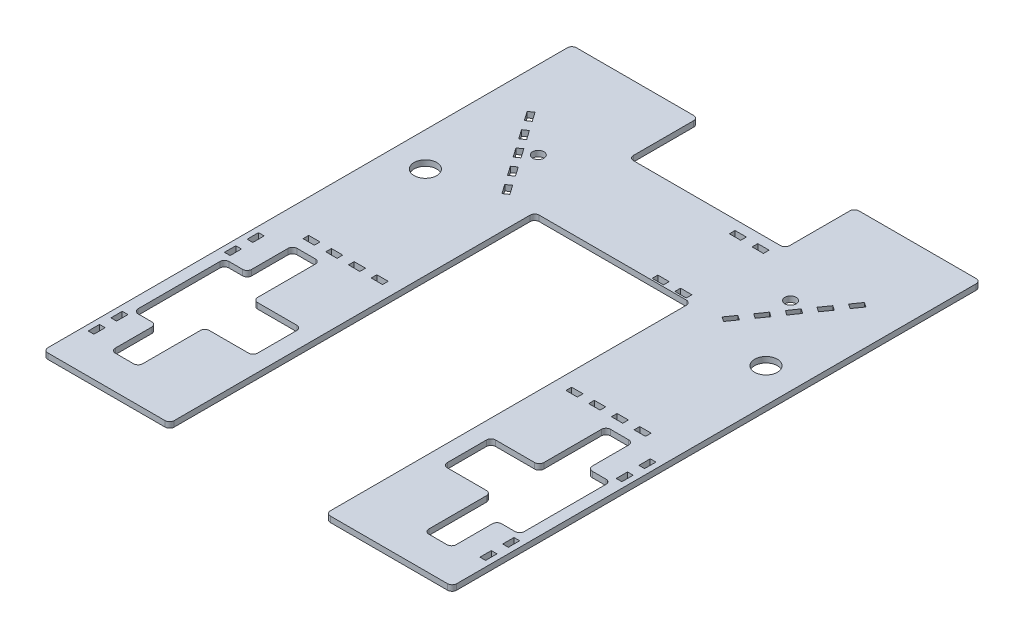
from build123d import *

# Parameters (mm, degrees)
SKETCH1_R           = 3.175
SKETCH1_R_2         = 6.35
SKETCH1_W           = 3.175
SKETCH1_H           = 6.35
SKETCH1_W_2         = 6.35
SKETCH1_H_2         = 3.175
BOSS_EXTRUDE1_DEPTH = 3.175
FILLET1_R           = 2.54


with BuildPart() as part:
    # Sketch1 → Boss-Extrude1 (new body)
    with BuildSketch(Plane(origin=(0, 0, 0), x_dir=(1, 0, 0), z_dir=(0, 1, 0))):
        Polygon((0, 0), (0, 279.4), (70.625, 279.4), (70.625, 240.639092), (157.975, 240.639092), (157.975, 279.4), (228.6, 279.4), (228.6, 0), (228.6, -16.1925), (157.975, -16.1925), (157.975, 0), (157.975, 178.425), (157.975, 187.95), (70.625, 187.95), (70.625, 178.425), (70.625, 0), (70.625, -16.1925), (0, -16.1925), align=None)
        with Locations(Location((184.833175285, 216.825060168, 0), (0, 0, 270))):
            Circle(SKETCH1_R, mode=Mode.SUBTRACT)
        with Locations(Location((209.55, 178.425, 0), (0, 0, 270))):
            Circle(SKETCH1_R_2, mode=Mode.SUBTRACT)
        with Locations(Location((43.766824715, 216.825060168, 0), (0, 0, 90))):
            Circle(SKETCH1_R, mode=Mode.SUBTRACT)
        with Locations(Location((19.05, 178.425, 0), (0, 0, 90))):
            Circle(SKETCH1_R_2, mode=Mode.SUBTRACT)
        Polygon((194.31, 66.84), (167.3225, 66.84), (167.3225, 39.84), (194.31, 39.84), (194.31, 2.54), (209.55, 2.54), (209.55, 27.94), (222.25, 27.94), (222.25, 78.74), (209.55, 78.74), (209.55, 104.14), (194.31, 104.14), align=None, mode=Mode.SUBTRACT)
        Polygon((19.05, 78.74), (6.35, 78.74), (6.35, 27.94), (19.05, 27.94), (19.05, 2.54), (34.29, 2.54), (34.29, 39.84), (61.2775, 39.84), (61.2775, 66.84), (34.29, 66.84), (34.29, 104.14), (19.05, 104.14), align=None, mode=Mode.SUBTRACT)
        with Locations((4.7625, 85.09)):
            Rectangle(SKETCH1_W, SKETCH1_H, mode=Mode.SUBTRACT)
        with Locations((4.7625, 97.79)):
            Rectangle(SKETCH1_W, SKETCH1_H, mode=Mode.SUBTRACT)
        with Locations((4.7625, 8.89)):
            Rectangle(SKETCH1_W, SKETCH1_H, mode=Mode.SUBTRACT)
        with Locations((4.7625, 21.59)):
            Rectangle(SKETCH1_W, SKETCH1_H, mode=Mode.SUBTRACT)
        with Locations((47.13, 112.0775)):
            Rectangle(SKETCH1_W_2, SKETCH1_H_2, mode=Mode.SUBTRACT)
        with Locations((59.83, 112.0775)):
            Rectangle(SKETCH1_W_2, SKETCH1_H_2, mode=Mode.SUBTRACT)
        with Locations((34.43, 112.0775)):
            Rectangle(SKETCH1_W_2, SKETCH1_H_2, mode=Mode.SUBTRACT)
        with Locations((21.73, 112.0775)):
            Rectangle(SKETCH1_W_2, SKETCH1_H_2, mode=Mode.SUBTRACT)
        with Locations((138.56250164, 233.66229998)):
            Rectangle(SKETCH1_W_2, SKETCH1_H_2, mode=Mode.SUBTRACT)
        with Locations((138.56250164, 190.48729998)):
            Rectangle(SKETCH1_W_2, SKETCH1_H_2, mode=Mode.SUBTRACT)
        with Locations((151.26250164, 190.48729998)):
            Rectangle(SKETCH1_W_2, SKETCH1_H_2, mode=Mode.SUBTRACT)
        with Locations((206.87, 112.0775)):
            Rectangle(SKETCH1_W_2, SKETCH1_H_2, mode=Mode.SUBTRACT)
        with Locations((194.17, 112.0775)):
            Rectangle(SKETCH1_W_2, SKETCH1_H_2, mode=Mode.SUBTRACT)
        with Locations((181.47, 112.0775)):
            Rectangle(SKETCH1_W_2, SKETCH1_H_2, mode=Mode.SUBTRACT)
        with Locations((168.77, 112.0775)):
            Rectangle(SKETCH1_W_2, SKETCH1_H_2, mode=Mode.SUBTRACT)
        with Locations((151.26250164, 233.66229998)):
            Rectangle(SKETCH1_W_2, SKETCH1_H_2, mode=Mode.SUBTRACT)
        with Locations((223.8375, 97.79)):
            Rectangle(SKETCH1_W, SKETCH1_H, mode=Mode.SUBTRACT)
        with Locations((223.8375, 21.59)):
            Rectangle(SKETCH1_W, SKETCH1_H, mode=Mode.SUBTRACT)
        with Locations((223.8375, 8.89)):
            Rectangle(SKETCH1_W, SKETCH1_H, mode=Mode.SUBTRACT)
        with Locations((223.8375, 85.09)):
            Rectangle(SKETCH1_W, SKETCH1_H, mode=Mode.SUBTRACT)
        Polygon((173.658953432, 189.769748471), (177.298450375, 194.973262861), (179.90020757, 193.15351439), (176.260710628, 187.95), align=None, mode=Mode.SUBTRACT)
        Polygon((180.937947318, 200.176777251), (183.539704513, 198.35702878), (187.179201455, 203.560543169), (184.57744426, 205.380291641), align=None, mode=Mode.SUBTRACT)
        Polygon((29.464567969, 226.1943492), (33.104064912, 220.99083481), (30.502307717, 219.171086339), (26.862810774, 224.374600729), align=None, mode=Mode.SUBTRACT)
        Polygon((188.216941203, 210.58380603), (191.856438146, 215.78732042), (194.458195341, 213.967571949), (190.818698398, 208.764057559), align=None, mode=Mode.SUBTRACT)
        Polygon((195.495935088, 220.99083481), (198.097692283, 219.171086339), (201.737189226, 224.374600729), (199.135432031, 226.1943492), align=None, mode=Mode.SUBTRACT)
        Polygon((36.743561854, 215.78732042), (34.141804659, 213.967571949), (37.781301602, 208.764057559), (40.383058797, 210.58380603), align=None, mode=Mode.SUBTRACT)
        Polygon((47.662052682, 200.176777251), (45.060295487, 198.35702878), (41.420798545, 203.560543169), (44.02255574, 205.380291641), align=None, mode=Mode.SUBTRACT)
        Polygon((51.301549625, 194.973262861), (48.69979243, 193.15351439), (52.339289372, 187.95), (54.941046567, 189.769748471), align=None, mode=Mode.SUBTRACT)
        Polygon((202.774928974, 231.39786359), (205.376686168, 229.578115118), (209.016183111, 234.781629508), (206.414425916, 236.601377979), align=None, mode=Mode.SUBTRACT)
        Polygon((22.185574084, 236.601377979), (19.583816889, 234.781629508), (23.223313832, 229.578115118), (25.825071026, 231.39786359), align=None, mode=Mode.SUBTRACT)
    extrude(amount=BOSS_EXTRUDE1_DEPTH)

    # Fillet1
    fillet1_edges = [part.edges().sort_by_distance(p)[0] for p in [
        (0, 1.5875, -279.4),
        (70.625, 1.5875, -279.4),
        (70.625, 1.5875, -240.639092),
        (157.975, 1.5875, -240.639092),
        (157.975, 1.5875, -279.4),
        (228.6, 1.5875, -279.4),
        (228.6, 1.5875, 16.1925),
        (157.975, 1.5875, 16.1925),
        (157.975, 1.5875, -187.95),
        (70.625, 1.5875, -187.95),
        (70.625, 1.5875, 16.1925),
        (0, 1.5875, 16.1925),
        (194.31, 1.5875, -104.14),
        (194.31, 1.5875, -66.84),
        (167.3225, 1.5875, -66.84),
        (167.3225, 1.5875, -39.84),
        (194.31, 1.5875, -39.84),
        (194.31, 1.5875, -2.54),
        (209.55, 1.5875, -2.54),
        (209.55, 1.5875, -27.94),
        (222.25, 1.5875, -27.94),
        (222.25, 1.5875, -78.74),
        (209.55, 1.5875, -78.74),
        (209.55, 1.5875, -104.14),
        (61.2775, 1.5875, -39.84),
        (61.2775, 1.5875, -66.84),
        (34.29, 1.5875, -66.84),
        (34.29, 1.5875, -104.14),
        (19.05, 1.5875, -104.14),
        (19.05, 1.5875, -78.74),
        (6.35, 1.5875, -78.74),
        (6.35, 1.5875, -27.94),
        (19.05, 1.5875, -27.94),
        (19.05, 1.5875, -2.54),
        (34.29, 1.5875, -2.54),
        (34.29, 1.5875, -39.84),
    ]]
    fillet(fillet1_edges, radius=FILLET1_R)


solid = part.part
